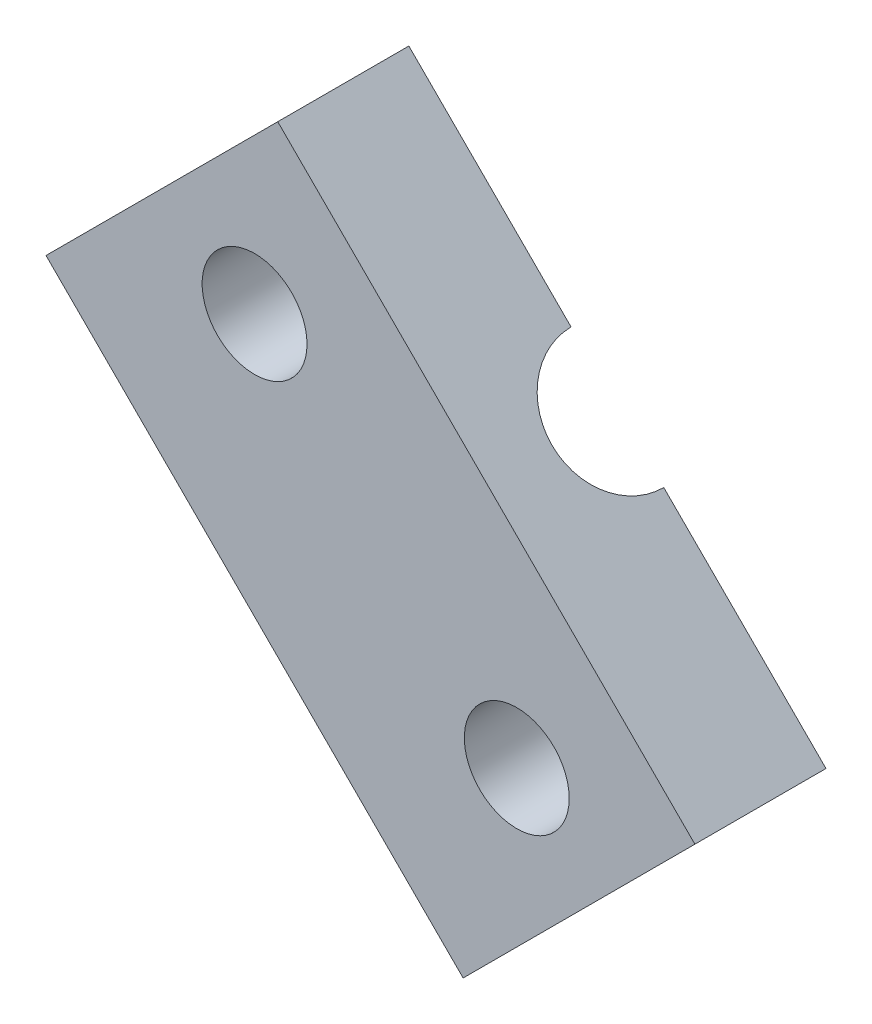
from build123d import *

# Parameters (mm, degrees)
EXTRUDE_1_DEPTH     = 10
SKETCH_4_R          = 1.6
CUT_EXTRUDE_1_DEPTH = 10


with BuildPart() as part:
    # 草图3 → 凸台-拉伸1 (new body)
    with BuildSketch(Plane(origin=(0, 0, 0), x_dir=(0, 0, -1), z_dir=(0.7071067811865488, 0.7071067811865464, 0))):
        with BuildLine():
            Line((0, 2), (0, 9))
            Line((0, 9), (-4, 9))
            Line((-4, 9), (-4, -9))
            Line((-4, -9), (0, -9))
            Line((0, -9), (0, -2))
            ThreePointArc((0, -2), (-2, 0), (0, 2))
        make_face()
    extrude(amount=EXTRUDE_1_DEPTH)

    # 草图4 → 切除-拉伸1 (cut)
    with BuildSketch(Plane.XY.offset(4)):
        with Locations((0, 8)):
            Circle(SKETCH_4_R)
        with Locations((8, 0)):
            Circle(SKETCH_4_R)
    extrude(amount=-CUT_EXTRUDE_1_DEPTH, mode=Mode.SUBTRACT)


solid = part.part
